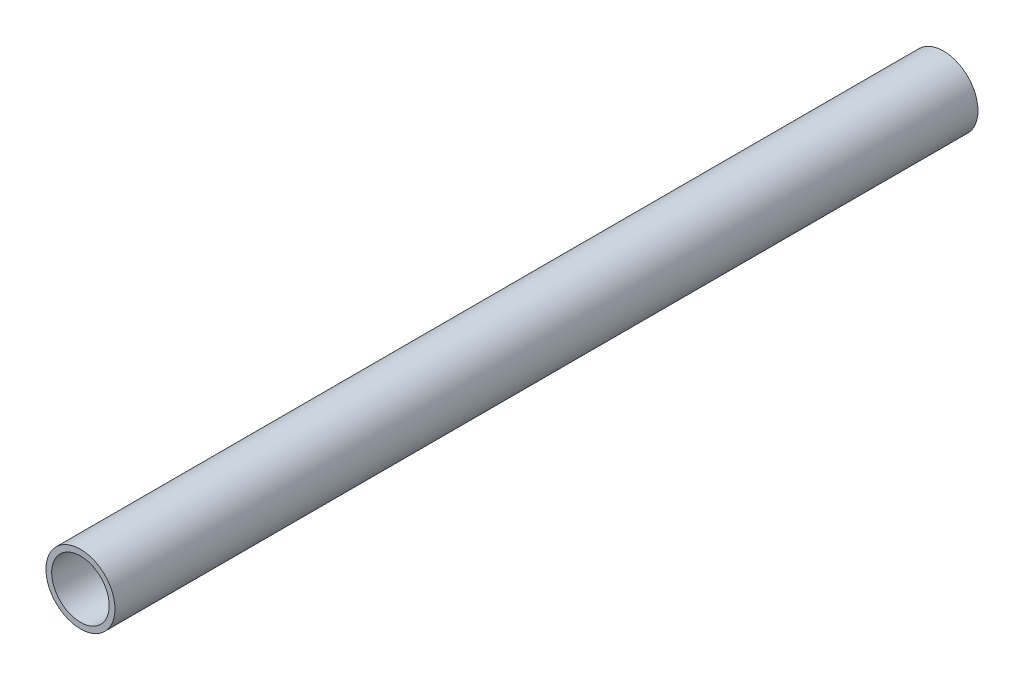
from build123d import *

# Parameters (mm, degrees)
SKETCH_1_R      = 6
SKETCH_1_R_2    = 5
EXTRUDE_1_DEPTH = 75


with BuildPart() as part:
    # 草图1 → 凸台-拉伸1 (new, symmetric)
    with BuildSketch(Plane.XY):
        Circle(SKETCH_1_R)
        Circle(SKETCH_1_R_2, mode=Mode.SUBTRACT)
    extrude(amount=EXTRUDE_1_DEPTH, both=True)


solid = part.part
